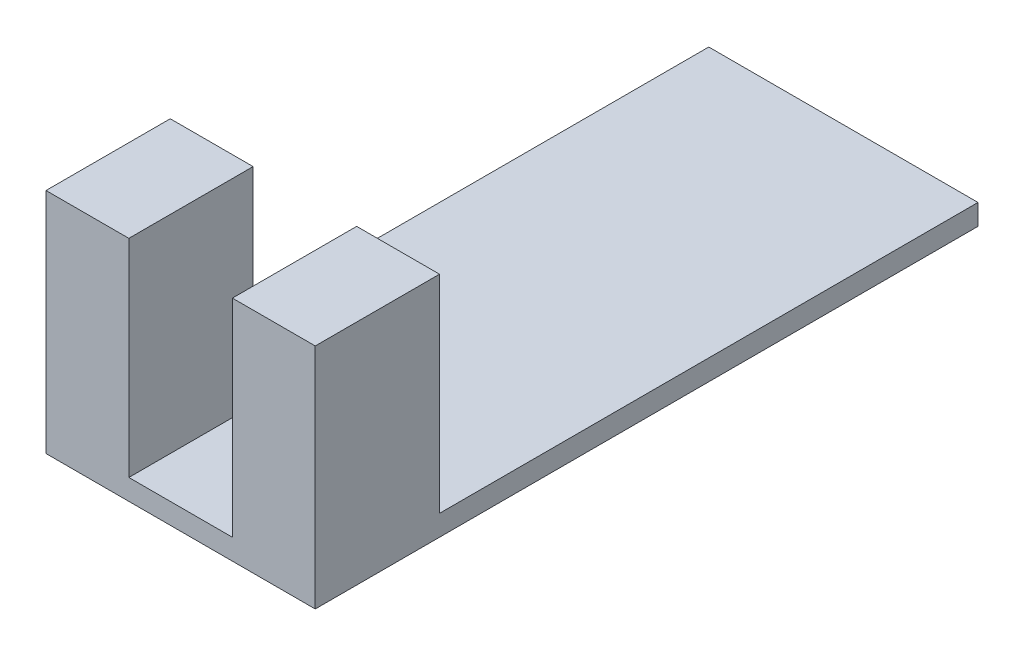
from build123d import *

# Parameters (mm, degrees)
SKETCH1_W           = 13
SKETCH1_H           = 32
BOSS_EXTRUDE1_DEPTH = 1
SKETCH2_W           = 4
SKETCH2_H           = 6
BOSS_EXTRUDE2_DEPTH = 10


with BuildPart() as part:
    # Sketch1 → Boss-Extrude1 (new body)
    with BuildSketch(Plane(origin=(0, 0, 0), x_dir=(1, 0, 0), z_dir=(0, 1, 0))):
        with Locations((6.5, -16)):
            Rectangle(SKETCH1_W, SKETCH1_H)
    extrude(amount=BOSS_EXTRUDE1_DEPTH)

    # Sketch2 → Boss-Extrude2 (add)
    with BuildSketch(Plane(origin=(0, 1, 0), x_dir=(1, 0, 0), z_dir=(0, 1, 0))):
        with Locations((11, -29)):
            Rectangle(SKETCH2_W, SKETCH2_H)
        with Locations((2, -29)):
            Rectangle(SKETCH2_W, SKETCH2_H)
    extrude(amount=BOSS_EXTRUDE2_DEPTH)


solid = part.part
